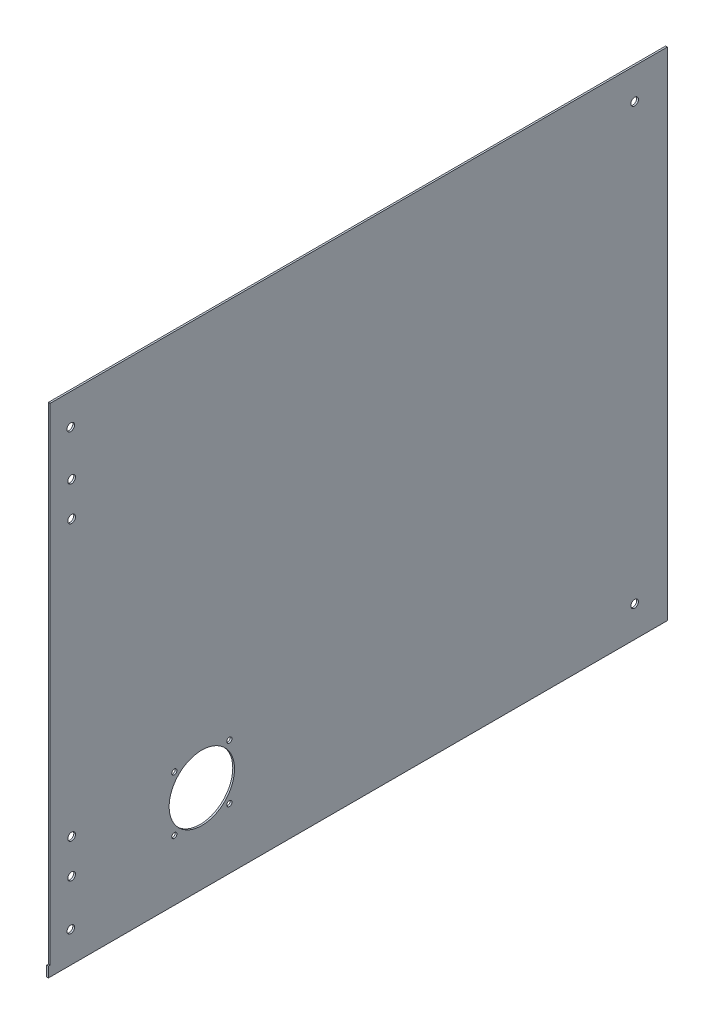
from build123d import *

# Parameters (mm, degrees)
SKETCH1_W           = 360
SKETCH1_H           = 283
SKETCH1_R           = 2.2
SKETCH1_R_2         = 2.25
BOSS_EXTRUDE1_DEPTH = 1
SKETCH3_R           = 18.999999993
SKETCH3_R_2         = 1.499999993
SKETCH3_W           = 1
SKETCH3_H           = 283
CUT_EXTRUDE1_DEPTH  = 1
SKETCH4_W           = 360
SKETCH4_H           = 6
BOSS_EXTRUDE2_DEPTH = 1


with BuildPart() as part:
    # Sketch1 → Boss-Extrude1 (new body)
    with BuildSketch(Plane(origin=(0, 0, 0), x_dir=(0, 0, -1), z_dir=(1, 0, 0))):
        Rectangle(SKETCH1_W, SKETCH1_H)
        with Locations((-167, 123.5)):
            Circle(SKETCH1_R, mode=Mode.SUBTRACT)
        with Locations((-167, -129.5)):
            Circle(SKETCH1_R, mode=Mode.SUBTRACT)
        with Locations(Location((161, 123.5, 0), (0, 0, 180))):
            Circle(SKETCH1_R, mode=Mode.SUBTRACT)
        with Locations(Location((161, -129.5, 0), (0, 0, 180))):
            Circle(SKETCH1_R, mode=Mode.SUBTRACT)
        with Locations((-166.5, 97.000820447)):
            Circle(SKETCH1_R_2, mode=Mode.SUBTRACT)
        with Locations((-166.5, 77.000820447)):
            Circle(SKETCH1_R_2, mode=Mode.SUBTRACT)
        with Locations((-166.5, -82.999179553)):
            Circle(SKETCH1_R_2, mode=Mode.SUBTRACT)
        with Locations((-166.5, -102.999179553)):
            Circle(SKETCH1_R_2, mode=Mode.SUBTRACT)
    extrude(amount=BOSS_EXTRUDE1_DEPTH)

    # Sketch3 → Cut-Extrude1 (cut)
    with BuildSketch(Plane(origin=(1, 0, 0), x_dir=(0, 0, -1), z_dir=(1, 0, 0))):
        with Locations((-90.763094033, -96.299179553)):
            Circle(SKETCH3_R)
        with Locations((-106.763094033, -80.299179553)):
            Circle(SKETCH3_R_2)
        with Locations((-74.763094033, -80.299179553)):
            Circle(SKETCH3_R_2)
        with Locations((-74.763094033, -112.299179553)):
            Circle(SKETCH3_R_2)
        with Locations((-106.763094033, -112.299179553)):
            Circle(SKETCH3_R_2)
        with Locations((-179.5, 0)):
            Rectangle(SKETCH3_W, SKETCH3_H)
    extrude(amount=-CUT_EXTRUDE1_DEPTH, mode=Mode.SUBTRACT)

    # Sketch4 → Boss-Extrude2 (add)
    with BuildSketch(Plane.ZY):
        with Locations((0, -144.5)):
            Rectangle(SKETCH4_W, SKETCH4_H)
    extrude(amount=-BOSS_EXTRUDE2_DEPTH)


solid = part.part
